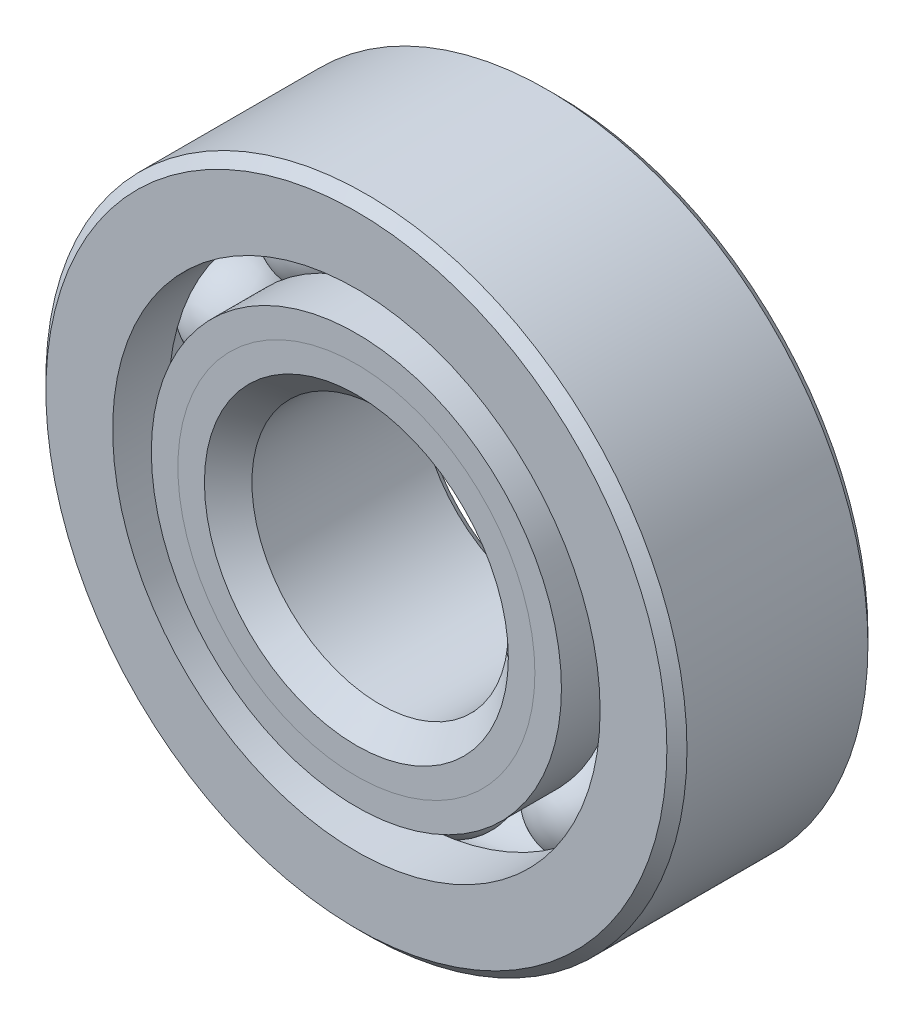
from build123d import *

# Parameters (mm, degrees)
CIRPATTERN1_COUNT = 10


with BuildPart() as part:
    # Sketch1 → Revolve1 (revolve)
    with BuildSketch(Plane(origin=(0, 0, 0), x_dir=(0, 0, -1), z_dir=(1, 0, 0)), mode=Mode.PRIVATE) as revolve1_sk:
        with BuildLine():
            Line((2.24028, 7.9375), (-2.24028, 7.9375))
            Line((-2.24028, 7.9375), (-2.4892, 7.68858))
            Line((-2.4892, 7.68858), (-2.4892, 6.035221429))
            Line((-2.4892, 6.035221429), (-1.106311111, 6.035221429))
            ThreePointArc((-1.106311111, 6.035221429), (0, 6.76179465), (1.106311111, 6.035221429))
            Line((1.106311111, 6.035221429), (2.4892, 6.035221429))
            Line((2.4892, 6.035221429), (2.4892, 7.68858))
            Line((2.4892, 7.68858), (2.24028, 7.9375))
        make_face()
    revolve(revolve1_sk.sketch.rotate(Axis((0, 0, 2.4892), (0, 0, -1)), 90), axis=Axis((0, 0, 2.4892), (0, 0, -1)))


with BuildPart() as body_2:
    # Sketch2 → Revolve2 (revolve)
    with BuildSketch(Plane(origin=(0, 0, 0), x_dir=(0, 0, -1), z_dir=(1, 0, 0)), mode=Mode.PRIVATE) as revolve2_sk:
        with BuildLine():
            Line((-2.4892, 5.077278571), (-1.106311111, 5.077278571))
            ThreePointArc((-1.106311111, 5.077278571), (-0.661784127, 4.548589505), (0, 4.35070535))
            Line((0, 4.35070535), (0, 3.762852675))
            Line((0, 3.762852675), (-1.831987052, 3.762852675))
            Line((-1.831987052, 3.762852675), (-2.4892, 4.420065623))
            Line((-2.4892, 4.420065623), (-2.4892, 5.077278571))
        make_face()
    revolve(revolve2_sk.sketch.rotate(Axis((0, 0, 2.4892), (0, 0, -1)), 90), axis=Axis((0, 0, 2.4892), (0, 0, -1)))


with BuildPart() as body_3:
    # Sketch3 → Revolve3 (revolve)
    with BuildSketch(Plane(origin=(0, 0, 0), x_dir=(0, 0, -1), z_dir=(1, 0, 0)), mode=Mode.PRIVATE) as revolve3_sk:
        with BuildLine():
            Line((-2.4892, 4.420065623), (-1.831987052, 3.762852675))
            Line((-1.831987052, 3.762852675), (0, 3.762852675))
            Line((0, 3.762852675), (0, 4.35070535))
            ThreePointArc((0, 4.35070535), (0.661784127, 4.548589505), (1.106311111, 5.077278571))
            Line((1.106311111, 5.077278571), (2.4892, 5.077278571))
            Line((2.4892, 5.077278571), (2.4892, 3.42392))
            Line((2.4892, 3.42392), (2.24028, 3.175))
            Line((2.24028, 3.175), (-1.901347325, 3.175))
            Line((-1.901347325, 3.175), (-2.4892, 3.762852675))
            Line((-2.4892, 3.762852675), (-2.4892, 4.420065623))
        make_face()
    revolve(revolve3_sk.sketch.rotate(Axis((0, 0, 2.4892), (0, 0, -1)), 90), axis=Axis((0, 0, 2.4892), (0, 0, -1)))


with BuildPart() as body_4:
    # Sketch4 → Revolve4 (revolve)
    with BuildSketch(Plane(origin=(0, 0, 0), x_dir=(0, 0, -1), z_dir=(1, 0, 0))):
        with BuildLine():
            Line((-1.20554465, 5.55625), (1.20554465, 5.55625))
            ThreePointArc((1.20554465, 5.55625), (0, 6.76179465), (-1.20554465, 5.55625))
        make_face()
    revolve(axis=Axis((0, 5.55625, 1.20554465), (0, 0, -1)))


with BuildPart() as cirpattern1_1:
    # CirPattern1: pattern copy
    add(body_4.part.rotate(Axis((0, 0, 0), (0, 0, 1)), 1 * 360 / CIRPATTERN1_COUNT))


with BuildPart() as cirpattern1_2:
    # CirPattern1: pattern copy
    add(body_4.part.rotate(Axis((0, 0, 0), (0, 0, 1)), 2 * 360 / CIRPATTERN1_COUNT))


with BuildPart() as cirpattern1_3:
    # CirPattern1: pattern copy
    add(body_4.part.rotate(Axis((0, 0, 0), (0, 0, 1)), 3 * 360 / CIRPATTERN1_COUNT))


with BuildPart() as cirpattern1_4:
    # CirPattern1: pattern copy
    add(body_4.part.rotate(Axis((0, 0, 0), (0, 0, 1)), 4 * 360 / CIRPATTERN1_COUNT))


with BuildPart() as cirpattern1_5:
    # CirPattern1: pattern copy
    add(body_4.part.rotate(Axis((0, 0, 0), (0, 0, 1)), 5 * 360 / CIRPATTERN1_COUNT))


with BuildPart() as cirpattern1_6:
    # CirPattern1: pattern copy
    add(body_4.part.rotate(Axis((0, 0, 0), (0, 0, 1)), 6 * 360 / CIRPATTERN1_COUNT))


with BuildPart() as cirpattern1_7:
    # CirPattern1: pattern copy
    add(body_4.part.rotate(Axis((0, 0, 0), (0, 0, 1)), 7 * 360 / CIRPATTERN1_COUNT))


with BuildPart() as cirpattern1_8:
    # CirPattern1: pattern copy
    add(body_4.part.rotate(Axis((0, 0, 0), (0, 0, 1)), 8 * 360 / CIRPATTERN1_COUNT))


with BuildPart() as cirpattern1_9:
    # CirPattern1: pattern copy
    add(body_4.part.rotate(Axis((0, 0, 0), (0, 0, 1)), 9 * 360 / CIRPATTERN1_COUNT))


solid = Compound([part.part, body_2.part, body_3.part, body_4.part, cirpattern1_1.part, cirpattern1_2.part, cirpattern1_3.part, cirpattern1_4.part, cirpattern1_5.part, cirpattern1_6.part, cirpattern1_7.part, cirpattern1_8.part, cirpattern1_9.part])
